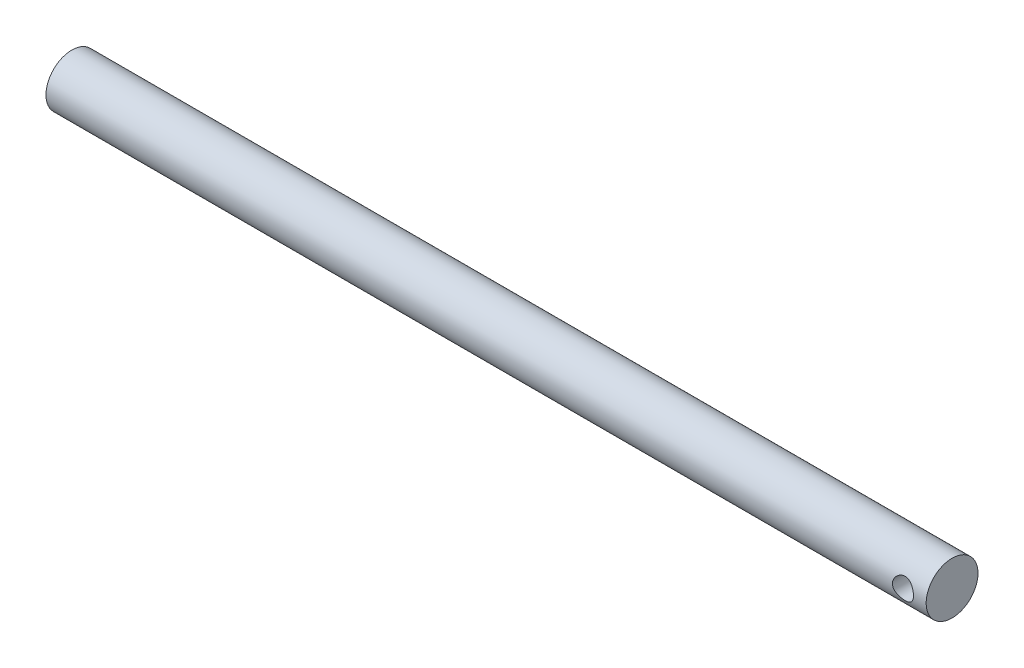
from build123d import *

# Parameters (mm, degrees)
SKETCH1_R           = 9.906
BOSS_EXTRUDE1_DEPTH = 336.55
SKETCH3_R           = 4.0132
CUT_EXTRUDE1_DEPTH  = 338.278144385


with BuildPart() as part:
    # Sketch1 → Boss-Extrude1 (new body)
    with BuildSketch(Plane(origin=(0, 0, 0), x_dir=(0, 0, -1), z_dir=(1, 0, 0))):
        Circle(SKETCH1_R)
    extrude(amount=BOSS_EXTRUDE1_DEPTH)

    # Sketch3 → Cut-Extrude1 (cut, through all)
    with BuildSketch(Plane(origin=(336.55, 0, 9.906), x_dir=(1, 0, 0), z_dir=(0, 0, 1))):
        with Locations((-8.89, 0)):
            Circle(SKETCH3_R)
    extrude(amount=-CUT_EXTRUDE1_DEPTH, mode=Mode.SUBTRACT)


solid = part.part
